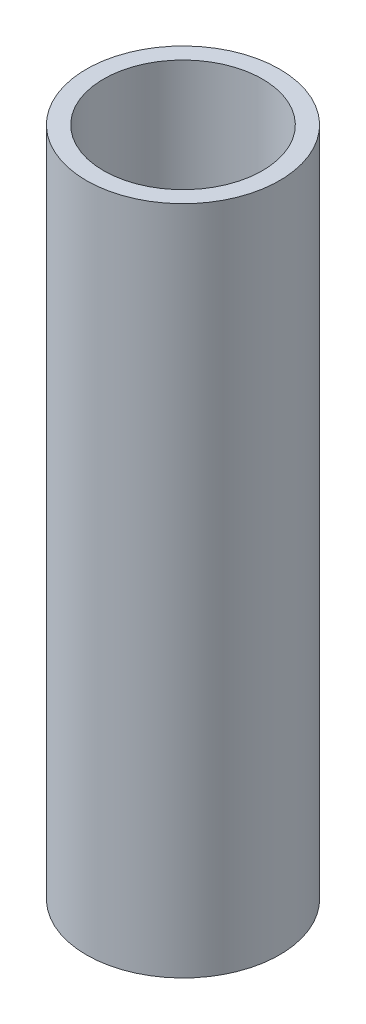
from build123d import *

# Parameters (mm, degrees)
SKETCH1_R           = 9.652
SKETCH1_R_2         = 7.9375
BOSS_EXTRUDE1_DEPTH = 67


with BuildPart() as part:
    # Sketch1 → Boss-Extrude1 (new body)
    with BuildSketch(Plane(origin=(0, 0, 0), x_dir=(1, 0, 0), z_dir=(0, 1, 0))):
        with Locations(Location((0, 0, 0), (0, 0, 270))):
            Circle(SKETCH1_R)
        with Locations(Location((0, 0, 0), (0, 0, 270))):
            Circle(SKETCH1_R_2, mode=Mode.SUBTRACT)
    extrude(amount=BOSS_EXTRUDE1_DEPTH)


solid = part.part
